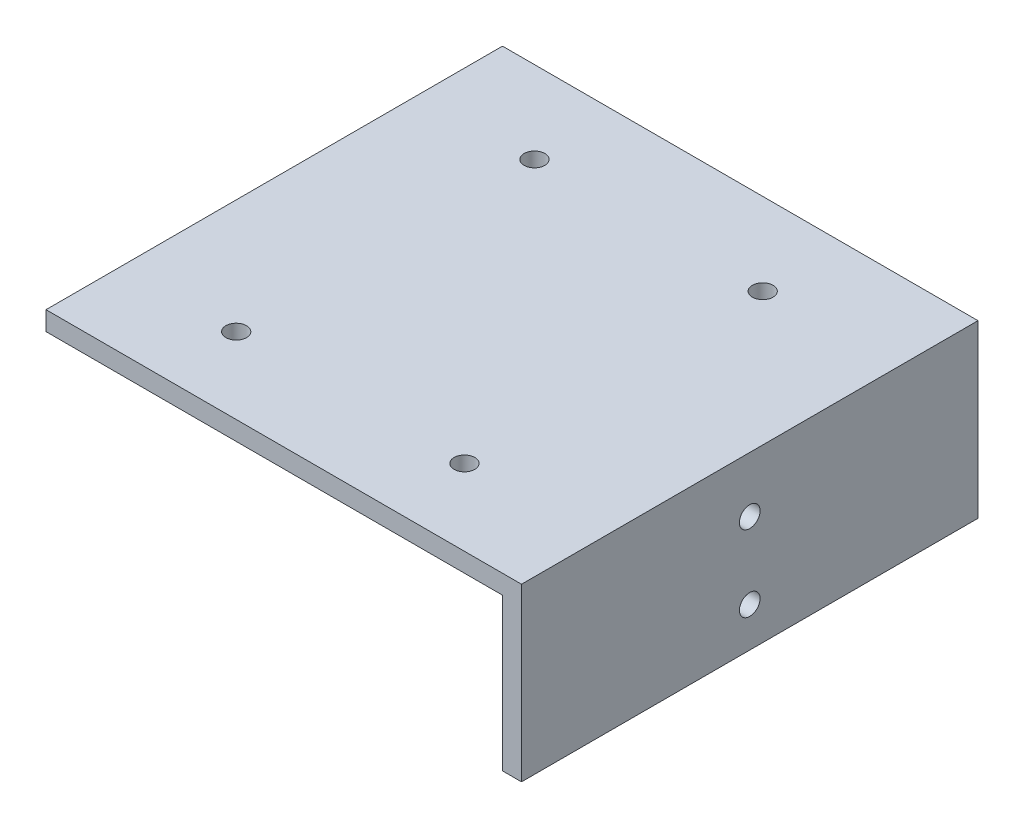
from build123d import *

# Parameters (mm, degrees)
BOSS_EXTRUDE1_DEPTH       = 76.2
TAP_DRILL_FOR_8_36_TAP1_D = 3.4544
TAP_DRILL_FOR_8_36_TAP2_D = 3.4544


with BuildPart() as part:
    # Sketch1 → Boss-Extrude1 (new body)
    with BuildSketch(Plane.XY):
        Polygon((0, 0), (0, 28.575), (-79.375, 28.575), (-79.375, 25.4), (-3.175, 25.4), (-3.175, 0), align=None)
    extrude(amount=BOSS_EXTRUDE1_DEPTH)

    # Tap Drill for #8-36 Tap1 (through all)
    with Locations(Plane.ZY.offset(3.175)):
        with Locations((38.1, 6.6), (38.1, 19.3)):
            Hole(TAP_DRILL_FOR_8_36_TAP1_D / 2)

    # Tap Drill for #8-36 Tap2 (through all)
    with Locations(Plane(origin=(0, 25.4, 0), x_dir=(-1, 0, 0), z_dir=(0, -1, 0))):
        with Locations((60.325, -63.5), (22.225, -63.5), (60.325, -13.711593905), (22.225, -13.711593905)):
            Hole(TAP_DRILL_FOR_8_36_TAP2_D / 2)


solid = part.part
